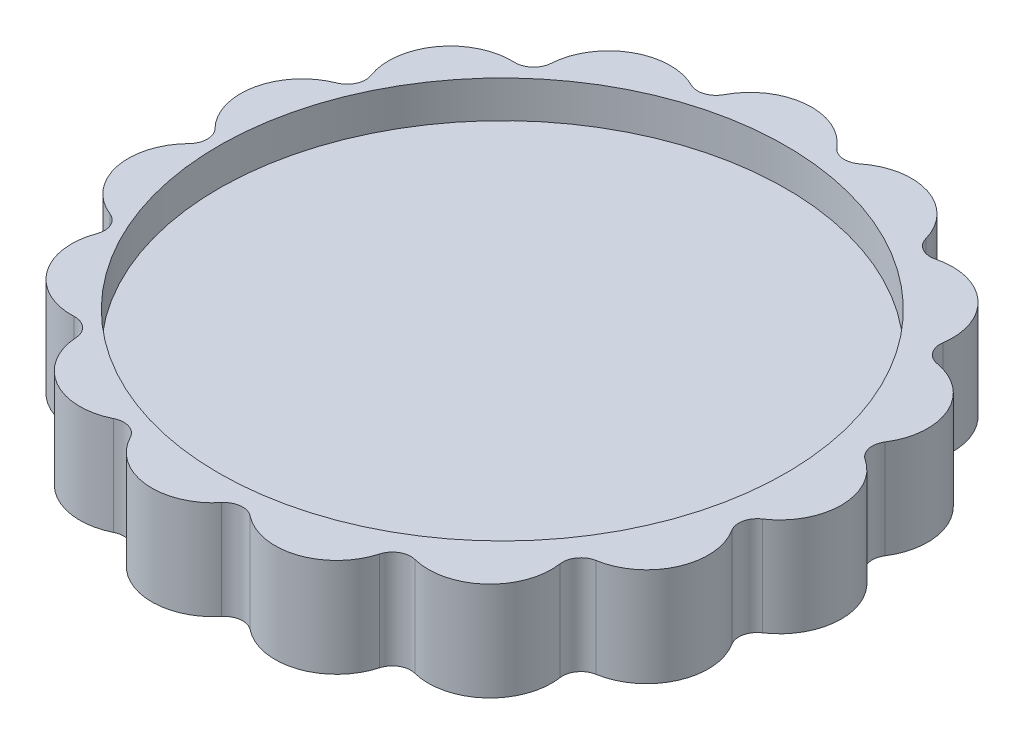
from build123d import *

# Parameters (mm, degrees)
SKETCH_1_R               = 22.5
EXTRUDE_1_DEPTH          = 8
SKETCH_3_R               = 5
EXTRUDE_3_DEPTH          = 8
PATTERN_CIRCULAR_1_COUNT = 15
FILLET_1_R               = 1.5
SKETCH_6_R               = 23
CUT_EXTRUDE_1_DEPTH      = 3


with BuildPart() as part:
    # 草图1 → 凸台-拉伸1 (new body)
    with BuildSketch(Plane(origin=(0, 0, 0), x_dir=(1, 0, 0), z_dir=(0, 1, 0))):
        with Locations(Location((0, 0, 0), (0, 0, 270))):
            Circle(SKETCH_1_R)
    extrude(amount=EXTRUDE_1_DEPTH)

    # 草图3 → 凸台-拉伸3 (add)
    with BuildSketch(Plane(origin=(0, 8, 0), x_dir=(1, 0, 0), z_dir=(0, 1, 0))):
        with Locations((22.5, 0)):
            Circle(SKETCH_3_R)
    extrude_3 = extrude(amount=-EXTRUDE_3_DEPTH)

    # 阵列(圆周)1: 凸台-拉伸3 ×15 about axis
    pattern_circular_1_axis = Axis((0.618008615, 0, 0), (0, 1, 0))
    for i in range(1, PATTERN_CIRCULAR_1_COUNT):
        add(extrude_3.rotate(pattern_circular_1_axis, i * 360 / PATTERN_CIRCULAR_1_COUNT))

    # 圆角1
    fillet_1_edges = [part.edges().sort_by_distance(p)[0] for p in [
        (23.58286781, 4, 4.88133151),
        (23.58286781, 4, -4.88133151),
        (19.612035026, 4, -13.799967965),
        (12.35696252, 4, -20.332464591),
        (3.072118239, 4, -23.349293374),
        (-6.637063891, 4, -22.328817212),
        (-15.091778074, 4, -17.447485702),
        (-20.83012742, 4, -9.549325409),
        (-22.859899195, 4, 0),
        (-20.83012742, 4, 9.549325409),
        (-15.091778074, 4, 17.447485702),
        (-6.637063891, 4, 22.328817212),
        (3.072118239, 4, 23.349293374),
        (12.35696252, 4, 20.332464591),
        (19.612035026, 4, 13.799967965),
    ]]
    fillet(fillet_1_edges, radius=FILLET_1_R)

    # 草图6 → 切除-拉伸1 (cut)
    with BuildSketch(Plane(origin=(0, 8, 0), x_dir=(1, 0, 0), z_dir=(0, 1, 0))):
        with Locations(Location((0, 0, 0), (0, 0, 270))):
            Circle(SKETCH_6_R)
    extrude(amount=-CUT_EXTRUDE_1_DEPTH, mode=Mode.SUBTRACT)


solid = part.part
